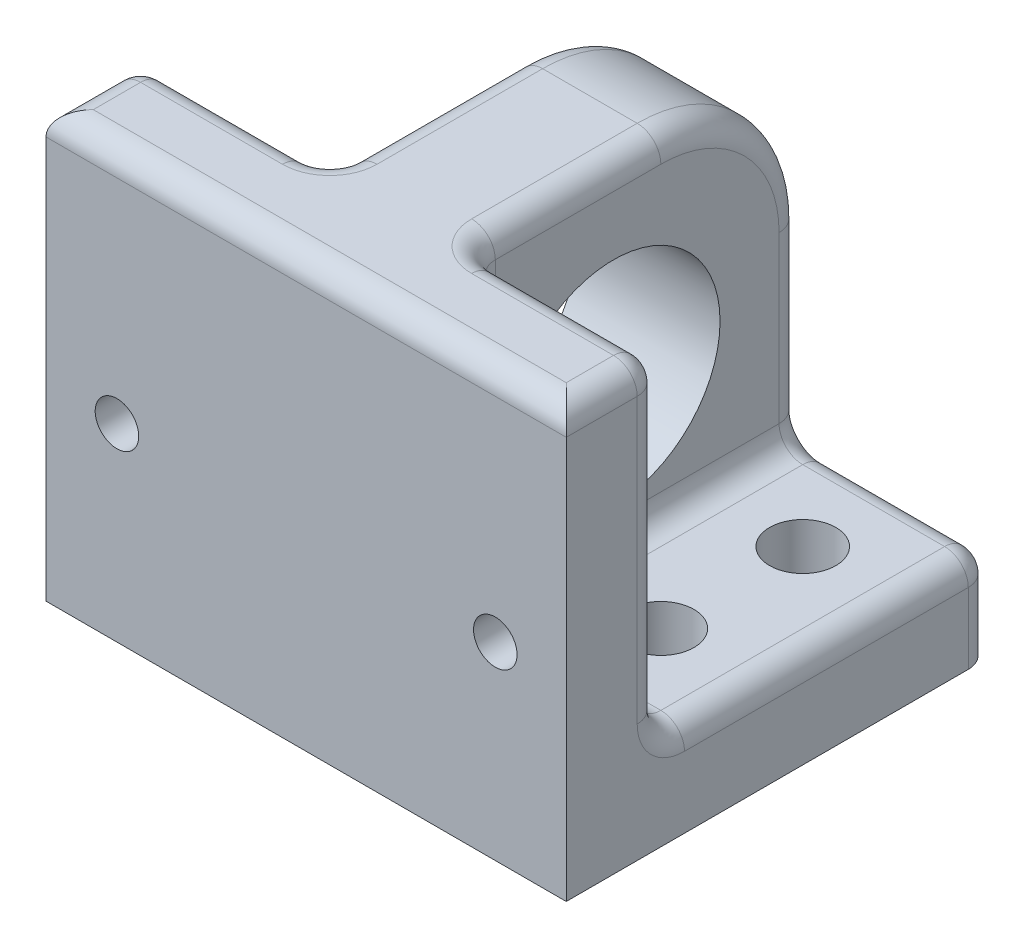
from build123d import *

# Parameters (mm, degrees)
SKETCH1_R           = 14.3002
BOSS_EXTRUDE1_DEPTH = 69.85
SKETCH2_W           = 25.4
SKETCH2_H           = 44.45
CUT_EXTRUDE1_DEPTH  = 44.45
FILLET1_R           = 3.175
SKETCH3_R           = 2.921
CUT_EXTRUDE2_DEPTH  = 107.823534499
SKETCH4_R           = 2.921
CUT_EXTRUDE3_DEPTH  = 107.823534499
SKETCH5_R           = 4.445
CUT_EXTRUDE4_DEPTH  = 6.35
CUT_EXTRUDE5_DEPTH  = 7.62


with BuildPart() as part:
    # Sketch1 → Boss-Extrude1 (new body)
    with BuildSketch(Plane(origin=(0, 0, 0), x_dir=(0, 0, -1), z_dir=(1, 0, 0))):
        with BuildLine():
            Line((0, 0), (57.15, 0))
            Line((57.15, 0), (57.15, 38.1))
            ThreePointArc((57.15, 38.1), (51.570384182, 51.570384182), (38.1, 57.15))
            Line((38.1, 57.15), (0, 57.15))
            Line((0, 57.15), (0, 0))
        make_face()
        with Locations((31.75, 31.75)):
            Circle(SKETCH1_R, mode=Mode.SUBTRACT)
    extrude(amount=BOSS_EXTRUDE1_DEPTH)

    # Sketch2 → Cut-Extrude1 (cut)
    with BuildSketch(Plane(origin=(0, 57.15, 0), x_dir=(1, 0, 0), z_dir=(0, 1, 0))):
        with Locations((12.7, 34.925)):
            Rectangle(SKETCH2_W, SKETCH2_H)
        with Locations((57.15, 34.925)):
            Rectangle(SKETCH2_W, SKETCH2_H)
    extrude(amount=-CUT_EXTRUDE1_DEPTH, mode=Mode.SUBTRACT)

    # Fillet1
    fillet1_edges = [part.edges().sort_by_distance(p)[0] for p in [
        (69.85, 6.35, -57.15),
        (0, 57.15, -6.35),
        (69.85, 57.15, -6.35),
        (0, 12.7, -34.925),
        (0, 34.925, -12.7),
        (25.4, 25.4, -57.15),
        (25.4, 51.570384182, -51.570384182),
        (25.4, 12.7, -34.925),
        (12.7, 12.7, -57.15),
        (12.7, 12.7, -12.7),
        (25.4, 34.925, -12.7),
        (25.4, 57.15, -25.4),
        (12.7, 57.15, -12.7),
        (44.45, 51.570384182, -51.570384182),
        (44.45, 12.7, -34.925),
        (44.45, 34.925, -12.7),
        (69.85, 12.7, -34.925),
        (57.15, 12.7, -12.7),
        (69.85, 34.925, -12.7),
        (57.15, 12.7, -57.15),
        (44.45, 25.4, -57.15),
        (44.45, 57.15, -25.4),
        (57.15, 57.15, -12.7),
        (0, 6.35, -57.15),
        (34.925, 57.15, 0),
    ]]
    fillet(fillet1_edges, radius=FILLET1_R)

    # Sketch3 → Cut-Extrude2 (cut, through all)
    with BuildSketch(Plane.XY):
        with Locations((9.525, 25.4)):
            Circle(SKETCH3_R)
        with Locations((60.325, 25.4)):
            Circle(SKETCH3_R)
    extrude(amount=-CUT_EXTRUDE2_DEPTH, mode=Mode.SUBTRACT)

    # Sketch4 → Cut-Extrude3 (cut, through all)
    with BuildSketch(Plane.XZ):
        with Locations(Location((57.15, -25.4, 0), (0, 0, 270))):
            Circle(SKETCH4_R)
        with Locations(Location((57.15, -44.45, 0), (0, 0, 270))):
            Circle(SKETCH4_R)
        with Locations(Location((12.7, -25.4, 0), (0, 0, 270))):
            Circle(SKETCH4_R)
        with Locations(Location((12.7, -44.45, 0), (0, 0, 270))):
            Circle(SKETCH4_R)
    extrude(amount=-CUT_EXTRUDE3_DEPTH, mode=Mode.SUBTRACT)

    # Sketch5 → Cut-Extrude4 (cut)
    with BuildSketch(Plane(origin=(0, 12.7, 0), x_dir=(1, 0, 0), z_dir=(0, 1, 0))):
        with Locations(Location((12.7, 25.4, 0), (0, 0, 270))):
            Circle(SKETCH5_R)
        with Locations(Location((12.7, 44.45, 0), (0, 0, 270))):
            Circle(SKETCH5_R)
        with Locations(Location((57.15, 44.45, 0), (0, 0, 270))):
            Circle(SKETCH5_R)
        with Locations(Location((57.15, 25.4, 0), (0, 0, 270))):
            Circle(SKETCH5_R)
    extrude(amount=-CUT_EXTRUDE4_DEPTH, mode=Mode.SUBTRACT)

    # Sketch6 → Cut-Extrude5 (cut)
    with BuildSketch(Plane(origin=(0, 0, -12.7), x_dir=(-1, 0, 0), z_dir=(0, 0, -1))):
        Polygon((-57.392060633, 30.48), (-63.257939367, 30.48), (-66.190878735, 25.4), (-63.257939367, 20.32), (-57.392060633, 20.32), (-54.459121265, 25.4), align=None)
        Polygon((-6.592060633, 30.48), (-12.457939367, 30.48), (-15.390878735, 25.4), (-12.457939367, 20.32), (-6.592060633, 20.32), (-3.659121265, 25.4), align=None)
    extrude(amount=-CUT_EXTRUDE5_DEPTH, mode=Mode.SUBTRACT)


solid = part.part
